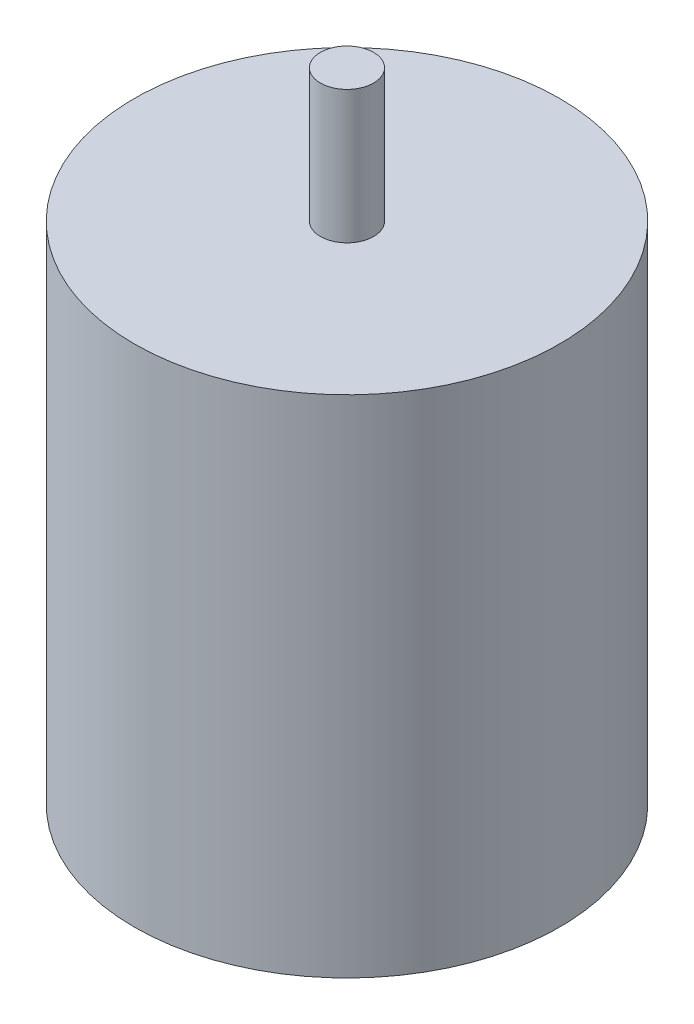
from build123d import *

# Parameters (mm, degrees)
SKETCH1_R           = 8
BOSS_EXTRUDE1_DEPTH = 19
SKETCH2_R           = 1
BOSS_EXTRUDE2_DEPTH = 5


with BuildPart() as part:
    # Sketch1 → Boss-Extrude1 (new body)
    with BuildSketch(Plane(origin=(0, 0, 0), x_dir=(1, 0, 0), z_dir=(0, 1, 0))):
        with Locations(Location((0, 0, 0), (0, 0, 270))):
            Circle(SKETCH1_R)
    extrude(amount=BOSS_EXTRUDE1_DEPTH)

    # Sketch2 → Boss-Extrude2 (add)
    with BuildSketch(Plane(origin=(0, 19, 0), x_dir=(1, 0, 0), z_dir=(0, 1, 0))):
        with Locations(Location((0, 0, 0), (0, 0, 270))):
            Circle(SKETCH2_R)
    extrude(amount=BOSS_EXTRUDE2_DEPTH)


solid = part.part
